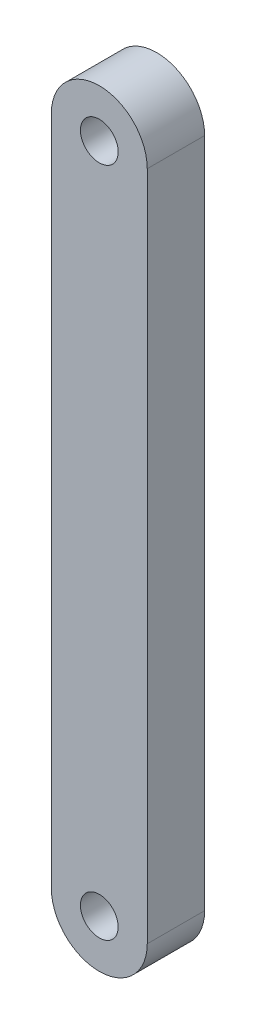
from build123d import *

# Parameters (mm, degrees)
BOSS_EXTRUDE1_DEPTH = 0.76
SKETCH2_R           = 0.25
CUT_EXTRUDE1_DEPTH  = 2.76


with BuildPart() as part:
    # Sketch1 → Boss-Extrude1 (new body)
    with BuildSketch(Plane.XY):
        with BuildLine():
            Line((158.870446182, 138.713740267), (158.870446182, 129.823740267))
            ThreePointArc((158.870446182, 129.823740267), (159.505446182, 129.188740267), (160.140446182, 129.823740267))
            Line((160.140446182, 129.823740267), (160.140446182, 138.713740267))
            ThreePointArc((160.140446182, 138.713740267), (159.505446182, 139.348740267), (158.870446182, 138.713740267))
        make_face()
    extrude(amount=BOSS_EXTRUDE1_DEPTH)

    # Sketch2 → Cut-Extrude1 (cut)
    with BuildSketch(Plane.XY.offset(0.76)):
        with Locations((159.505446182, 138.713740267)):
            Circle(SKETCH2_R)
        with Locations((159.505446182, 129.823740267)):
            Circle(SKETCH2_R)
    extrude(amount=-CUT_EXTRUDE1_DEPTH, mode=Mode.SUBTRACT)


solid = part.part
